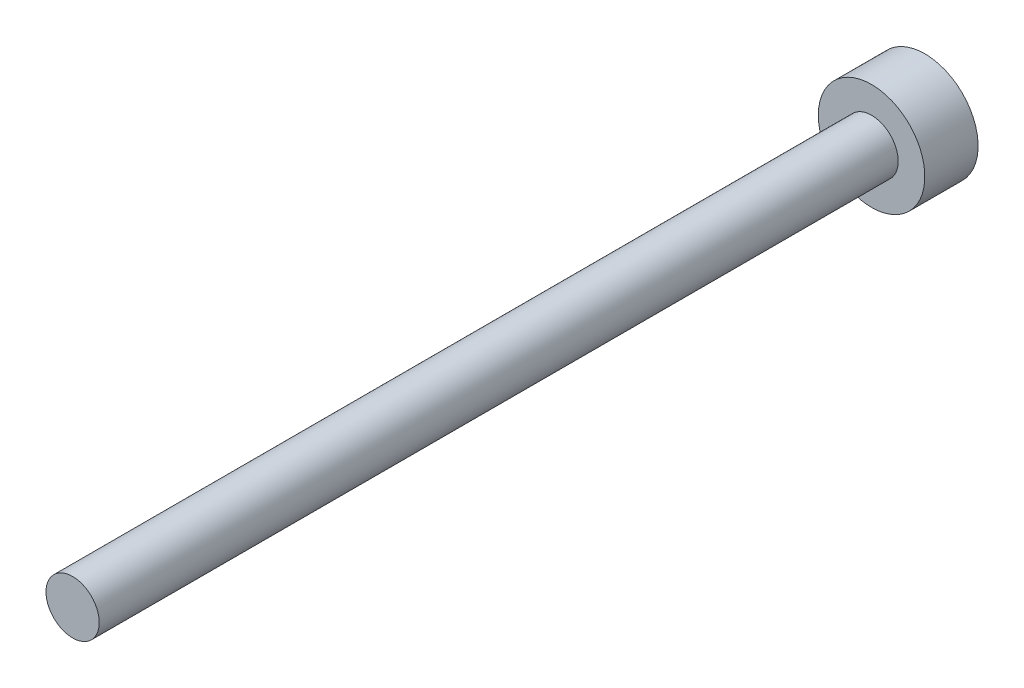
from build123d import *

# Parameters (mm, degrees)
SKETCH_1_R      = 1.5
EXTRUDE_1_DEPTH = 45
SKETCH_2_R      = 3
EXTRUDE_2_DEPTH = 3


with BuildPart() as part:
    # 草图1 → 凸台-拉伸1 (new body)
    with BuildSketch(Plane.XY):
        with Locations(Location((0, 0, 0), (0, 0, 180))):
            Circle(SKETCH_1_R)
    extrude(amount=EXTRUDE_1_DEPTH)

    # 草图2 → 凸台-拉伸2 (add)
    with BuildSketch(Plane(origin=(0, 0, 0), x_dir=(-1, 0, 0), z_dir=(0, 0, -1))):
        Circle(SKETCH_2_R)
    extrude(amount=EXTRUDE_2_DEPTH)


solid = part.part
